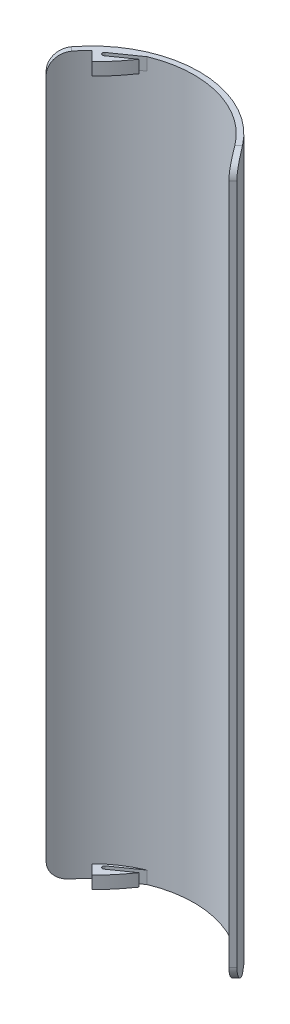
from build123d import *

# Parameters (mm, degrees)
SKETCH1_W           = 3
SKETCH1_H           = 400
SKETCH6_OUTSIDE_W   = 208.902
SKETCH6_OUTSIDE_H   = 208.902
CUT_EXTRUDE2_DEPTH  = 409.900966005
BOSS_EXTRUDE4_DEPTH = 7
FILLET1_R           = 10


with BuildPart() as part:
    # Sketch1 → Revolve1 (revolve)
    with BuildSketch(Plane.XY, mode=Mode.PRIVATE) as revolve1_sk:
        with Locations((58.5, 0)):
            Rectangle(SKETCH1_W, SKETCH1_H)
    revolve(revolve1_sk.sketch.rotate(Axis((0, 0, 0), (0, 1, 0)), 90), axis=Axis((0, 0, 0), (0, 1, 0)))

    # Sketch6 outside → Cut-Extrude2 (cut, through all)
    with BuildSketch(Plane(origin=(0, 200, 0), x_dir=(1, 0, 0), z_dir=(0, 1, 0))):
        Rectangle(SKETCH6_OUTSIDE_W, SKETCH6_OUTSIDE_H)
        with BuildLine():
            Line((0, -25.455844123), (53.200134751, 27.744290628))
            ThreePointArc((53.200134751, 27.744290628), (0, 60), (-53.200134751, 27.744290628))
            Line((-53.200134751, 27.744290628), (0, -25.455844123))
        make_face(mode=Mode.SUBTRACT)
    extrude(amount=-CUT_EXTRUDE2_DEPTH, mode=Mode.SUBTRACT)

    # Sketch7 → Boss-Extrude4 (add)
    with BuildSketch(Plane(origin=(0, 200, 0), x_dir=(1, 0, 0), z_dir=(0, 1, 0))):
        with BuildLine():
            Line((-35.629141961, 42.982621722), (-21.797880868, 52.667375003))
            ThreePointArc((-21.797880868, 52.667375003), (-31.660719889, 47.398299717), (-40.305086528, 40.305086528))
            Line((-40.305086528, 40.305086528), (-34.793335026, 34.793335026))
            ThreePointArc((-34.793335026, 34.793335026), (-28.516275136, 41.671387576), (-22.892502884, 49.093130862))
            Line((-22.892502884, 49.093130862), (-34.309916158, 41.09857202))
            ThreePointArc((-34.309916158, 41.09857202), (-35.91155391, 41.380983969), (-35.629141961, 42.982621722))
        make_face()
    boss_extrude4 = extrude(amount=-BOSS_EXTRUDE4_DEPTH)

    # Mirror1: Boss-Extrude4 across plane
    add(boss_extrude4.mirror(Plane.ZX))

    # Fillet1
    fillet1_edges = [part.edges().sort_by_distance(p)[0] for p in [
        (52.085351582, 200, -26.629507459),
        (-52.085351582, -200, -26.629507459),
        (52.085351582, -200, -26.629507459),
        (-52.085351582, 200, -26.629507459),
    ]]
    fillet(fillet1_edges, radius=FILLET1_R)


solid = part.part
